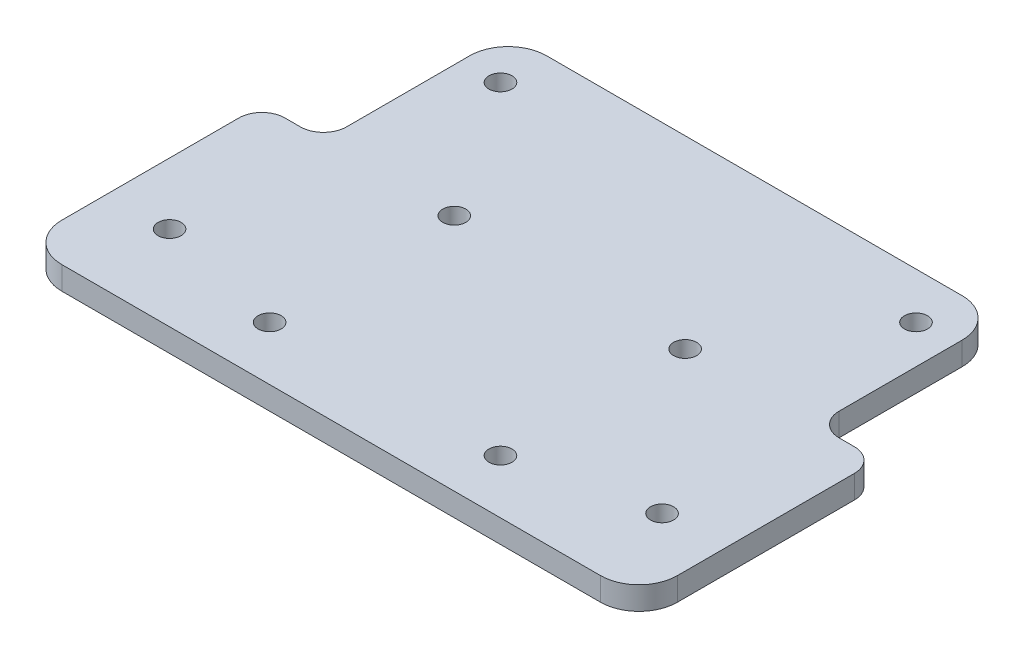
from build123d import *

# Parameters (mm, degrees)
EXTRUDE_1_DEPTH     = 3
SKETCH_2_R          = 1.5
CUT_EXTRUDE_1_DEPTH = 3
FILLET_1_R          = 3
SKETCH_3_R          = 1.5
CUT_EXTRUDE_2_DEPTH = 10
SKETCH_4_W          = 80
SKETCH_4_H          = 5
EXTRUDE_2_DEPTH     = 3
FILLET_2_R          = 5


with BuildPart() as part:
    # 草图1 → 凸台-拉伸1 (new body)
    with BuildSketch(Plane(origin=(0, 0, 0), x_dir=(1, 0, 0), z_dir=(0, 1, 0))):
        Polygon((-40, 1), (-40, -25), (40, -25), (40, 1), (32, 1), (32, 25), (-32, 25), (-32, 1), align=None)
    extrude(amount=EXTRUDE_1_DEPTH)

    # 草图2 → 切除-拉伸1 (cut)
    with BuildSketch(Plane(origin=(0, 3, 0), x_dir=(1, 0, 0), z_dir=(0, 1, 0))):
        with Locations(Location((-32, -19, 0), (0, 0, 270))):
            Circle(SKETCH_2_R)
        with Locations(Location((32, -19, 0), (0, 0, 90))):
            Circle(SKETCH_2_R)
        with Locations(Location((-27, 19, 0), (0, 0, 270))):
            Circle(SKETCH_2_R)
        with Locations(Location((27, 19, 0), (0, 0, 90))):
            Circle(SKETCH_2_R)
    extrude(amount=-CUT_EXTRUDE_1_DEPTH, mode=Mode.SUBTRACT)

    # 圆角1
    fillet_1_edges = [part.edges().sort_by_distance(p)[0] for p in [
        (32, 1.5, -1),
        (40, 1.5, -1),
        (-40, 1.5, -1),
        (-32, 1.5, -1),
    ]]
    fillet(fillet_1_edges, radius=FILLET_1_R)

    # 草图3 → 切除-拉伸2 (cut)
    with BuildSketch(Plane(origin=(0, 3, 0), x_dir=(1, 0, 0), z_dir=(0, 1, 0))):
        with Locations(Location((-15, 1, 0), (0, 0, 270))):
            Circle(SKETCH_3_R)
        with Locations(Location((-15, -23, 0), (0, 0, 270))):
            Circle(SKETCH_3_R)
        with Locations(Location((15, -23, 0), (0, 0, 270))):
            Circle(SKETCH_3_R)
        with Locations(Location((15, 1, 0), (0, 0, 270))):
            Circle(SKETCH_3_R)
    extrude(amount=-CUT_EXTRUDE_2_DEPTH, mode=Mode.SUBTRACT)

    # 草图4 → 凸台-拉伸2 (add)
    with BuildSketch(Plane(origin=(0, 3, 0), x_dir=(1, 0, 0), z_dir=(0, 1, 0))):
        with Locations((0, -27.5)):
            Rectangle(SKETCH_4_W, SKETCH_4_H)
    extrude(amount=-EXTRUDE_2_DEPTH)

    # 圆角2
    fillet_2_edges = [part.edges().sort_by_distance(p)[0] for p in [
        (-32, 1.5, -25),
        (32, 1.5, -25),
        (40, 1.5, 30),
        (-40, 1.5, 30),
    ]]
    fillet(fillet_2_edges, radius=FILLET_2_R)


solid = part.part
